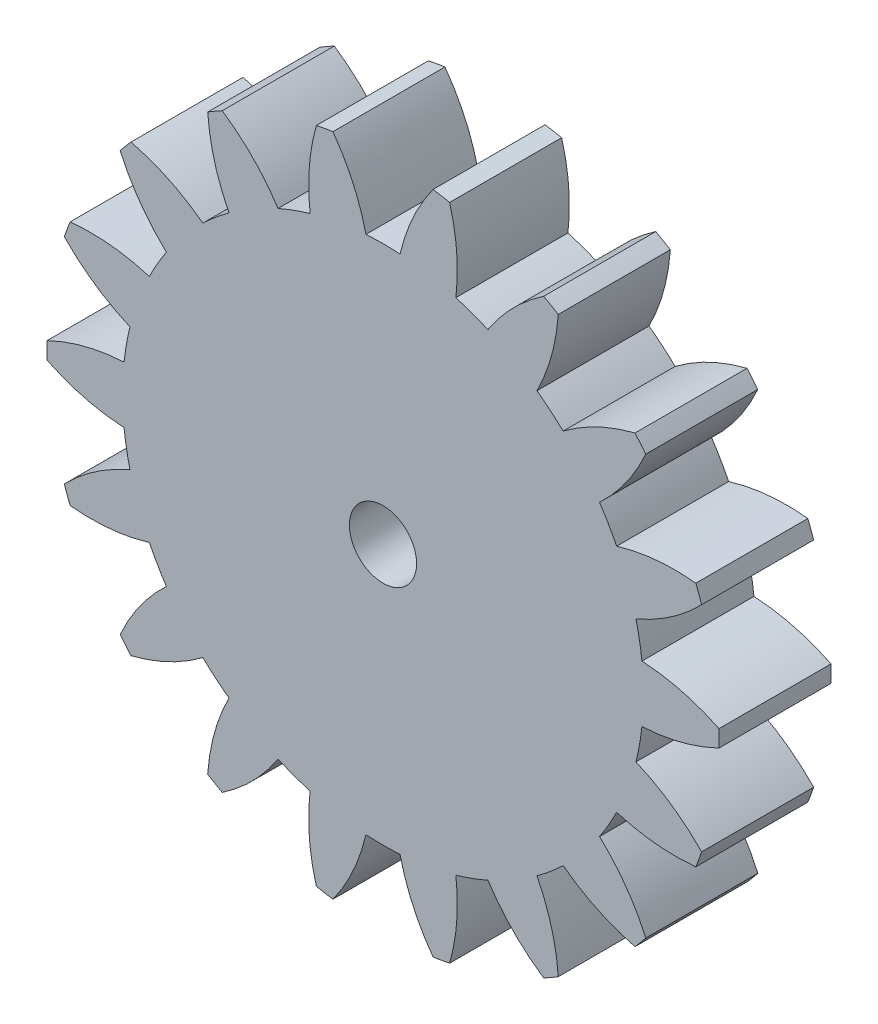
from build123d import *

# Parameters (mm, degrees)
SKETCH1_R           = 3
BOSS_EXTRUDE1_DEPTH = 10


with BuildPart() as part:
    # Sketch1 → Boss-Extrude1 (new body)
    with BuildSketch(Plane.XY):
        with BuildLine():
            ThreePointArc((-6.504789318, 22.320477525), (-7.951626312, 21.846913741), (-9.364368684, 21.279675753))
            add(Edge.make_bspline(
                [(-14.34407304, 26.348578114), (-11.348209695, 24.318322412), (-9.364368684, 21.279675753)],
                knots=[0, 0, 0, 1, 1, 1], degree=2))
            ThreePointArc((-14.34407304, 26.348578114), (-15, 25.980762114), (-15.646501481, 25.596620703))
            add(Edge.make_bspline(
                [(-15.646501481, 25.596620703), (-15.386180139, 21.98699909), (-13.746555444, 18.749619047)],
                knots=[0, 0, 0, 1, 1, 1], degree=2))
            ThreePointArc((-13.746555444, 18.749619047), (-14.944169138, 17.809767258), (-16.077705902, 16.793551558))
            add(Edge.make_bspline(
                [(-22.49076405, 19.853602505), (-18.981185027, 18.970431814), (-16.077705902, 16.793551558)],
                knots=[0, 0, 0, 1, 1, 1], degree=2))
            ThreePointArc((-22.49076405, 19.853602505), (-22.981333294, 19.283628291), (-23.457461864, 18.701536913))
            add(Edge.make_bspline(
                [(-23.457461864, 18.701536913), (-21.978276518, 15.398637262), (-19.330284106, 12.917279798)],
                knots=[0, 0, 0, 1, 1, 1], degree=2))
            ThreePointArc((-19.330284106, 12.917279798), (-20.134224613, 11.6245), (-20.851834506, 10.281877199))
            add(Edge.make_bspline(
                [(-27.924736988, 10.963989426), (-24.324749311, 11.334427165), (-20.851834506, 10.281877199)],
                knots=[0, 0, 0, 1, 1, 1], degree=2))
            ThreePointArc((-27.924736988, 10.963989426), (-28.190778624, 10.2606043), (-28.439106151, 9.550771765))
            add(Edge.make_bspline(
                [(-28.439106151, 9.550771765), (-25.919468385, 6.95297252), (-22.58249522, 5.526925967)],
                knots=[0, 0, 0, 1, 1, 1], degree=2))
            ThreePointArc((-22.58249522, 5.526925967), (-22.89579545, 4.037146483), (-23.110924128, 2.530056705))
            add(Edge.make_bspline(
                [(-29.99057452, 0.751957411), (-26.734389834, 2.331323322), (-23.110924128, 2.530056705)],
                knots=[0, 0, 0, 1, 1, 1], degree=2))
            ThreePointArc((-29.99057452, 0.751957411), (-30, 0), (-29.99057452, -0.751957411))
            add(Edge.make_bspline(
                [(-29.99057452, -0.751957411), (-26.734389834, -2.331323322), (-23.110924128, -2.530056705)],
                knots=[0, 0, 0, 1, 1, 1], degree=2))
            ThreePointArc((-23.110924128, -2.530056705), (-22.89579545, -4.037146483), (-22.58249522, -5.526925967))
            add(Edge.make_bspline(
                [(-28.439106151, -9.550771765), (-25.919468385, -6.95297252), (-22.58249522, -5.526925967)],
                knots=[0, 0, 0, 1, 1, 1], degree=2))
            ThreePointArc((-28.439106151, -9.550771765), (-28.190778624, -10.2606043), (-27.924736988, -10.963989426))
            add(Edge.make_bspline(
                [(-27.924736988, -10.963989426), (-24.324749311, -11.334427165), (-20.851834506, -10.281877199)],
                knots=[0, 0, 0, 1, 1, 1], degree=2))
            ThreePointArc((-20.851834506, -10.281877199), (-20.134224613, -11.6245), (-19.330284106, -12.917279798))
            add(Edge.make_bspline(
                [(-23.457461864, -18.701536913), (-21.978276518, -15.398637262), (-19.330284106, -12.917279798)],
                knots=[0, 0, 0, 1, 1, 1], degree=2))
            ThreePointArc((-23.457461864, -18.701536913), (-22.981333294, -19.283628291), (-22.49076405, -19.853602505))
            add(Edge.make_bspline(
                [(-22.49076405, -19.853602505), (-18.981185027, -18.970431814), (-16.077705902, -16.793551558)],
                knots=[0, 0, 0, 1, 1, 1], degree=2))
            ThreePointArc((-16.077705902, -16.793551558), (-14.944169138, -17.809767258), (-13.746555444, -18.749619047))
            add(Edge.make_bspline(
                [(-15.646501481, -25.596620703), (-15.386180139, -21.98699909), (-13.746555444, -18.749619047)],
                knots=[0, 0, 0, 1, 1, 1], degree=2))
            ThreePointArc((-15.646501481, -25.596620703), (-15, -25.980762114), (-14.34407304, -26.348578114))
            add(Edge.make_bspline(
                [(-14.34407304, -26.348578114), (-11.348209695, -24.318322412), (-9.364368684, -21.279675753)],
                knots=[0, 0, 0, 1, 1, 1], degree=2))
            ThreePointArc((-9.364368684, -21.279675753), (-7.951626312, -21.846913741), (-6.504789318, -22.320477525))
            add(Edge.make_bspline(
                [(-5.948342101, -29.404374271), (-6.938283358, -25.923404334), (-6.504789318, -22.320477525)],
                knots=[0, 0, 0, 1, 1, 1], degree=2))
            ThreePointArc((-5.948342101, -29.404374271), (-5.20944533, -29.54423259), (-4.467275124, -29.665526339))
            add(Edge.make_bspline(
                [(-4.467275124, -29.665526339), (-2.346472793, -26.733064427), (-1.5215504, -23.199156997)],
                knots=[0, 0, 0, 1, 1, 1], degree=2))
            ThreePointArc((-1.5215504, -23.199156997), (0, -23.249), (1.5215504, -23.199156997))
            add(Edge.make_bspline(
                [(4.467275124, -29.665526339), (2.346472793, -26.733064427), (1.5215504, -23.199156997)],
                knots=[0, 0, 0, 1, 1, 1], degree=2))
            ThreePointArc((4.467275124, -29.665526339), (5.20944533, -29.54423259), (5.948342101, -29.404374271))
            add(Edge.make_bspline(
                [(5.948342101, -29.404374271), (6.938283358, -25.923404334), (6.504789318, -22.320477525)],
                knots=[0, 0, 0, 1, 1, 1], degree=2))
            ThreePointArc((6.504789318, -22.320477525), (7.951626312, -21.846913741), (9.364368684, -21.279675753))
            add(Edge.make_bspline(
                [(14.34407304, -26.348578114), (11.348209695, -24.318322412), (9.364368684, -21.279675753)],
                knots=[0, 0, 0, 1, 1, 1], degree=2))
            ThreePointArc((14.34407304, -26.348578114), (15, -25.980762114), (15.646501481, -25.596620703))
            add(Edge.make_bspline(
                [(15.646501481, -25.596620703), (15.386180139, -21.98699909), (13.746555444, -18.749619047)],
                knots=[0, 0, 0, 1, 1, 1], degree=2))
            ThreePointArc((13.746555444, -18.749619047), (14.944169138, -17.809767258), (16.077705902, -16.793551558))
            add(Edge.make_bspline(
                [(22.49076405, -19.853602505), (18.981185027, -18.970431814), (16.077705902, -16.793551558)],
                knots=[0, 0, 0, 1, 1, 1], degree=2))
            ThreePointArc((22.49076405, -19.853602505), (22.981333294, -19.283628291), (23.457461864, -18.701536913))
            add(Edge.make_bspline(
                [(23.457461864, -18.701536913), (21.978276518, -15.398637262), (19.330284106, -12.917279798)],
                knots=[0, 0, 0, 1, 1, 1], degree=2))
            ThreePointArc((19.330284106, -12.917279798), (20.134224613, -11.6245), (20.851834506, -10.281877199))
            add(Edge.make_bspline(
                [(27.924736988, -10.963989426), (24.324749311, -11.334427165), (20.851834506, -10.281877199)],
                knots=[0, 0, 0, 1, 1, 1], degree=2))
            ThreePointArc((27.924736988, -10.963989426), (28.190778624, -10.2606043), (28.439106151, -9.550771765))
            add(Edge.make_bspline(
                [(28.439106151, -9.550771765), (25.919468385, -6.95297252), (22.58249522, -5.526925967)],
                knots=[0, 0, 0, 1, 1, 1], degree=2))
            ThreePointArc((22.58249522, -5.526925967), (22.89579545, -4.037146483), (23.110924128, -2.530056705))
            add(Edge.make_bspline(
                [(29.99057452, -0.751957411), (26.734389834, -2.331323322), (23.110924128, -2.530056705)],
                knots=[0, 0, 0, 1, 1, 1], degree=2))
            ThreePointArc((29.99057452, -0.751957411), (30, 0), (29.99057452, 0.751957411))
            add(Edge.make_bspline(
                [(29.99057452, 0.751957411), (26.734389834, 2.331323322), (23.110924128, 2.530056705)],
                knots=[0, 0, 0, 1, 1, 1], degree=2))
            ThreePointArc((23.110924128, 2.530056705), (22.89579545, 4.037146483), (22.58249522, 5.526925967))
            add(Edge.make_bspline(
                [(28.439106151, 9.550771765), (25.919468385, 6.95297252), (22.58249522, 5.526925967)],
                knots=[0, 0, 0, 1, 1, 1], degree=2))
            ThreePointArc((28.439106151, 9.550771765), (28.190778624, 10.2606043), (27.924736988, 10.963989426))
            add(Edge.make_bspline(
                [(27.924736988, 10.963989426), (24.324749311, 11.334427165), (20.851834506, 10.281877199)],
                knots=[0, 0, 0, 1, 1, 1], degree=2))
            ThreePointArc((20.851834506, 10.281877199), (20.134224613, 11.6245), (19.330284106, 12.917279798))
            add(Edge.make_bspline(
                [(23.457461864, 18.701536913), (21.978276518, 15.398637262), (19.330284106, 12.917279798)],
                knots=[0, 0, 0, 1, 1, 1], degree=2))
            ThreePointArc((23.457461864, 18.701536913), (22.981333294, 19.283628291), (22.49076405, 19.853602505))
            add(Edge.make_bspline(
                [(22.49076405, 19.853602505), (18.981185027, 18.970431814), (16.077705902, 16.793551558)],
                knots=[0, 0, 0, 1, 1, 1], degree=2))
            ThreePointArc((16.077705902, 16.793551558), (14.944169138, 17.809767258), (13.746555444, 18.749619047))
            add(Edge.make_bspline(
                [(15.646501481, 25.596620703), (15.386180139, 21.98699909), (13.746555444, 18.749619047)],
                knots=[0, 0, 0, 1, 1, 1], degree=2))
            ThreePointArc((15.646501481, 25.596620703), (15, 25.980762114), (14.34407304, 26.348578114))
            add(Edge.make_bspline(
                [(14.34407304, 26.348578114), (11.348209695, 24.318322412), (9.364368684, 21.279675753)],
                knots=[0, 0, 0, 1, 1, 1], degree=2))
            ThreePointArc((9.364368684, 21.279675753), (7.951626312, 21.846913741), (6.504789318, 22.320477525))
            add(Edge.make_bspline(
                [(5.948342101, 29.404374271), (6.938283358, 25.923404334), (6.504789318, 22.320477525)],
                knots=[0, 0, 0, 1, 1, 1], degree=2))
            ThreePointArc((5.948342101, 29.404374271), (5.20944533, 29.54423259), (4.467275124, 29.665526339))
            add(Edge.make_bspline(
                [(4.467275124, 29.665526339), (2.346472793, 26.733064427), (1.5215504, 23.199156997)],
                knots=[0, 0, 0, 1, 1, 1], degree=2))
            ThreePointArc((1.5215504, 23.199156997), (0, 23.249), (-1.5215504, 23.199156997))
            add(Edge.make_bspline(
                [(-4.467275124, 29.665526339), (-2.346472793, 26.733064427), (-1.5215504, 23.199156997)],
                knots=[0, 0, 0, 1, 1, 1], degree=2))
            ThreePointArc((-4.467275124, 29.665526339), (-5.20944533, 29.54423259), (-5.948342101, 29.404374271))
            add(Edge.make_bspline(
                [(-5.948342101, 29.404374271), (-6.938283358, 25.923404334), (-6.504789318, 22.320477525)],
                knots=[0, 0, 0, 1, 1, 1], degree=2))
        make_face()
        Circle(SKETCH1_R, mode=Mode.SUBTRACT)
    extrude(amount=BOSS_EXTRUDE1_DEPTH)


solid = part.part
